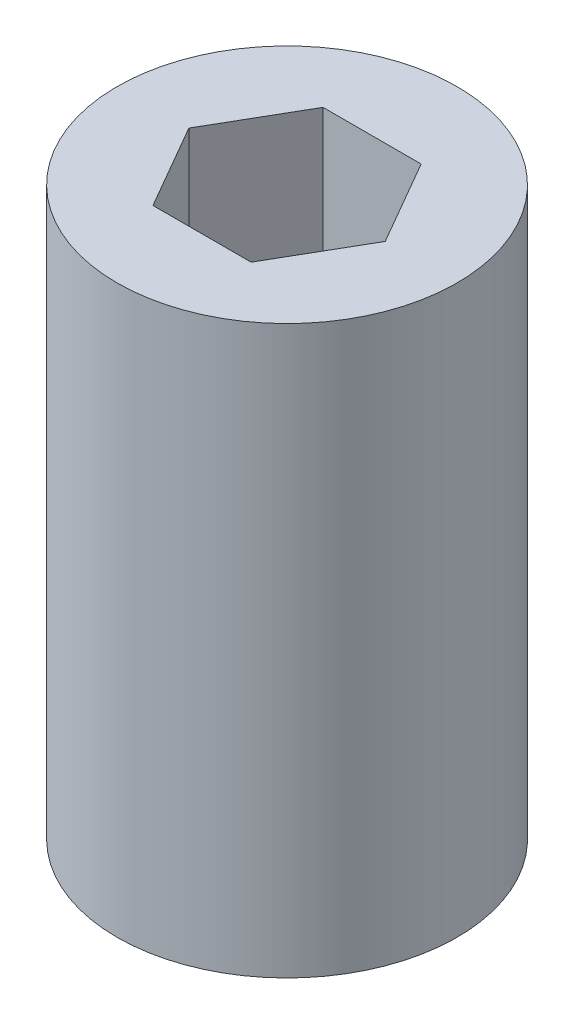
from build123d import *

# Parameters (mm, degrees)
SKETCH1_W           = 1.5
SKETCH1_H           = 5
SKETCH3_R           = 0.75
BOSS_EXTRUDE1_DEPTH = 0.5
CUT_EXTRUDE1_DEPTH  = 2


with BuildPart() as part:
    # Sketch1 → Revolve1 (revolve)
    with BuildSketch(Plane.XY, mode=Mode.PRIVATE) as revolve1_sk:
        with Locations((0.75, -2.5)):
            Rectangle(SKETCH1_W, SKETCH1_H)
    revolve(revolve1_sk.sketch.rotate(Axis((0, 61.691642626, 0), (0, -1, 0)), 90), axis=Axis((0, 61.691642626, 0), (0, -1, 0)))

    # Sketch2 → Cut-Extrude1 (cut)
    with BuildSketch(Plane(origin=(0, 0, 0), x_dir=(-1, 0, 0), z_dir=(0, 1, 0))):
        Polygon((-0.433012702, -0.75), (0.433012702, -0.75), (0.866025404, 0), (0.433012702, 0.75), (-0.433012702, 0.75), (-0.866025404, 0), align=None)
    extrude(amount=-CUT_EXTRUDE1_DEPTH, mode=Mode.SUBTRACT)


with BuildPart() as body_2:
    # Sketch3 → Boss-Extrude1 (new body)
    with BuildSketch(Plane.XZ.offset(5)):
        with Locations(Location((0, 0, 0), (0, 0, 270))):
            Circle(SKETCH3_R)
    extrude(amount=BOSS_EXTRUDE1_DEPTH)


solid = Compound([part.part, body_2.part])
